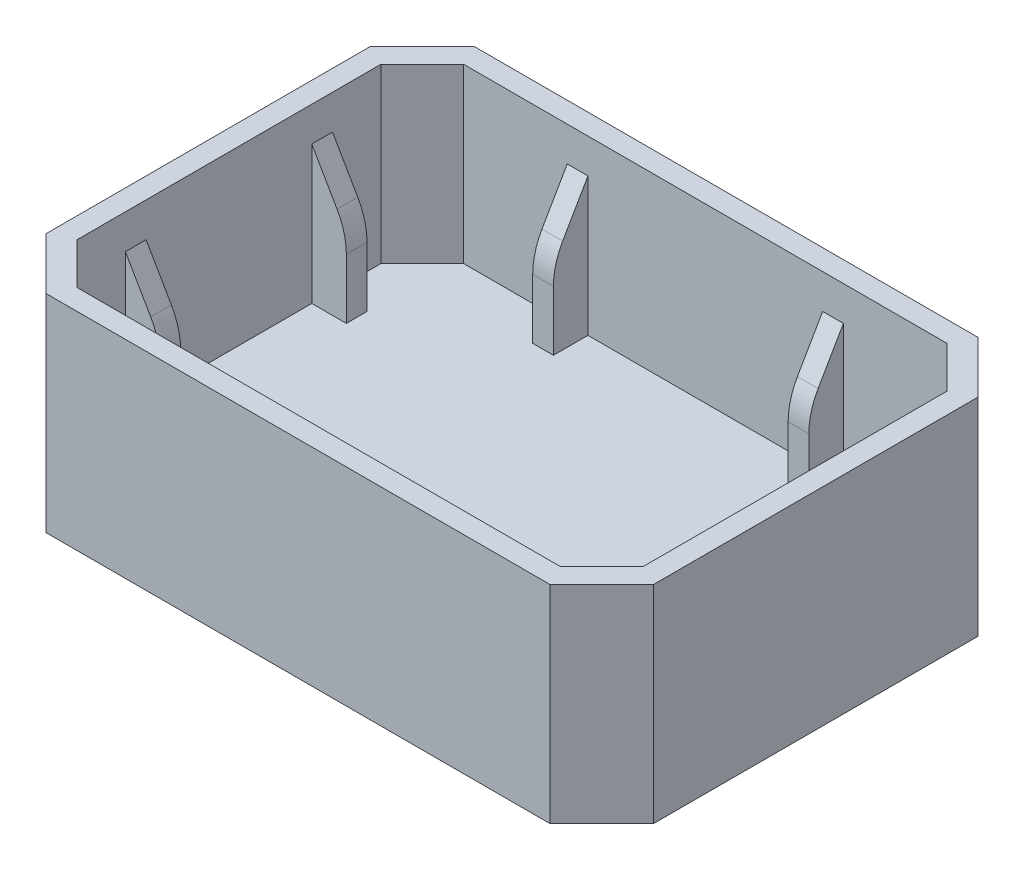
from build123d import *

# Parameters (mm, degrees)
SKETCH_3_W                 = 88
SKETCH_3_H                 = 62
EXTRUDE_2_DEPTH            = 30
SHELL_1_T                  = -3
SHELL_1_THICKNESS_2_FACE_W = 56
SHELL_1_THICKNESS_2_FACE_H = 82
SHELL_1_THICKNESS_2_DEPTH  = 2
EXTRUDE_3_DEPTH            = 15
FILLET_1_R                 = 10
CUT_EXTRUDE_1_DEPTH        = 12
EXTRUDE_4_DEPTH            = 20
FILLET_2_R                 = 10
CUT_EXTRUDE_2_DEPTH        = 17
CHAMFER_1_SIZE             = 6
CHAMFER_2_SIZE             = 7.5


with BuildPart() as part:
    # 草图3 → 凸台-拉伸2 (new body)
    with BuildSketch(Plane(origin=(0, 0, 0), x_dir=(1, 0, 0), z_dir=(0, 1, 0))):
        Rectangle(SKETCH_3_W, SKETCH_3_H)
    extrude(amount=EXTRUDE_2_DEPTH)

    # 抽壳1
    shell_1_openings = [part.faces().sort_by_distance(p)[0] for p in [
        (0, 30, 0),
    ]]
    offset(amount=SHELL_1_T, openings=shell_1_openings, kind=Kind.INTERSECTION)

    # 抽壳1 thickness 2 face (on inner face of the shell) → 抽壳1 thickness 2 (add)
    with BuildSketch(Plane(origin=(0, 3, 0), x_dir=(0, 0, -1), z_dir=(0, -1, 0))):
        Rectangle(SHELL_1_THICKNESS_2_FACE_W, SHELL_1_THICKNESS_2_FACE_H)
    extrude(amount=-SHELL_1_THICKNESS_2_DEPTH)

    # 草图5 → 凸台-拉伸3 (add, symmetric)
    with BuildSketch(Plane.XY):
        Polygon((-41, 25), (-41, 5), (-36, 5), (-36, 16.339745962), align=None)
        Polygon((36, 5), (41, 5), (41, 25), (36, 16.339745962), align=None)
    extrude(amount=EXTRUDE_3_DEPTH, both=True)

    # 圆角1
    fillet_1_edges = [part.edges().sort_by_distance(p)[0] for p in [
        (-36, 16.339745962, 0),
        (36, 16.339745962, 0),
    ]]
    fillet(fillet_1_edges, radius=FILLET_1_R)

    # 草图6 → 切除-拉伸1 (cut, symmetric)
    with BuildSketch(Plane.XY):
        Polygon((36, 5), (41, 5), (41, 25), (36, 16.339745962), align=None)
        Polygon((-41, 25), (-41, 5), (-36, 5), (-36, 16.339745962), align=None)
    extrude(amount=CUT_EXTRUDE_1_DEPTH, both=True, mode=Mode.SUBTRACT)

    # 草图7 → 凸台-拉伸4 (add, symmetric)
    with BuildSketch(Plane(origin=(0, 0, 0), x_dir=(0, 0, -1), z_dir=(1, 0, 0))):
        Polygon((-28, 25), (-23, 16.339745962), (-23, 5), (-28, 5), align=None)
        Polygon((23, 5), (28, 5), (28, 25), (23, 16.339745962), align=None)
    extrude(amount=EXTRUDE_4_DEPTH, both=True)

    # 圆角2
    fillet_2_edges = [part.edges().sort_by_distance(p)[0] for p in [
        (0, 16.339745962, 23),
        (0, 16.339745962, -23),
    ]]
    fillet(fillet_2_edges, radius=FILLET_2_R)

    # 草图8 → 切除-拉伸2 (cut, symmetric)
    with BuildSketch(Plane(origin=(0, 0, 0), x_dir=(0, 0, -1), z_dir=(1, 0, 0))):
        Polygon((23, 5), (28, 5), (28, 25), (23, 16.339745962), align=None)
        Polygon((-23, 16.339745962), (-28, 25), (-28, 5), (-23, 5), align=None)
    extrude(amount=CUT_EXTRUDE_2_DEPTH, both=True, mode=Mode.SUBTRACT)

    # 倒角1
    chamfer_1_edges = [part.edges().sort_by_distance(p)[0] for p in [
        (-41, 17.5, -28),
        (-41, 17.5, 28),
        (41, 17.5, 28),
        (41, 17.5, -28),
    ]]
    chamfer(chamfer_1_edges, length=CHAMFER_1_SIZE)

    # 倒角2
    chamfer_2_edges = [part.edges().sort_by_distance(p)[0] for p in [
        (-44, 15, -31),
        (44, 15, -31),
        (44, 15, 31),
        (-44, 15, 31),
    ]]
    chamfer(chamfer_2_edges, length=CHAMFER_2_SIZE)


solid = part.part
